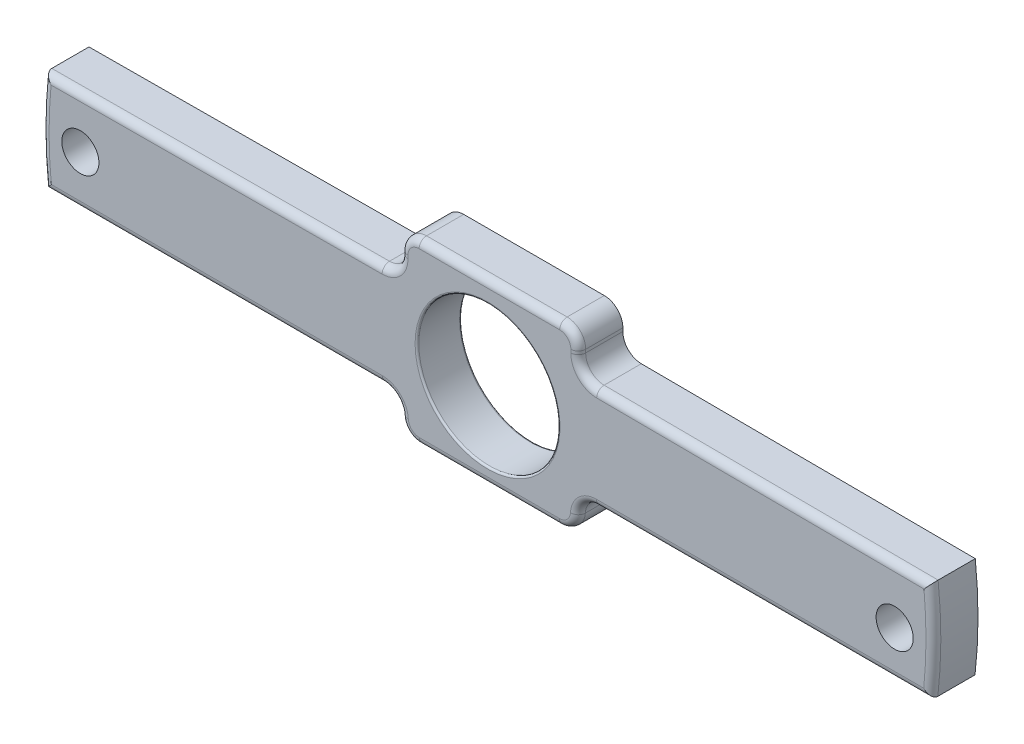
from build123d import *

# Parameters (mm, degrees)
ESQUISSE1_W             = 200
ESQUISSE1_H             = 24
BOSS_EXTRU_1_DEPTH      = 6
ESQUISSE3_R             = 9.5
ENL_V_MAT_EXTRU_1_DEPTH = 6
ESQUISSE4_R             = 114.275088212
ESQUISSE4_R_2           = 60
ENL_V_MAT_EXTRU_2_DEPTH = 6
ESQUISSE5_W             = 52.011744551
ESQUISSE5_H             = 15.54113196
ESQUISSE5_W_2           = 52.011744552
ENL_V_MAT_EXTRU_3_DEPTH = 6
CONG_1_R                = 2.5
CONG_2_R                = 2.5
CONG_3_R                = 1
CONG_4_R                = 0.25
CONG_5_R                = 0.25
ESQUISSE6_R             = 2.5
ENL_V_MAT_EXTRU_4_DEPTH = 68.365782888


with BuildPart() as part:
    # Esquisse1 → Boss.-Extru.1 (new body)
    with BuildSketch(Plane.XY):
        with Locations((-5.765391807, 0)):
            Rectangle(ESQUISSE1_W, ESQUISSE1_H)
    extrude(amount=BOSS_EXTRU_1_DEPTH)

    # Esquisse3 → Enlèv. mat.-Extru.1 (cut)
    with BuildSketch(Plane.XY.offset(6)):
        with Locations((-6.016275927, -0.323603958)):
            Circle(ESQUISSE3_R)
    extrude(amount=-ENL_V_MAT_EXTRU_1_DEPTH, mode=Mode.SUBTRACT)

    # Esquisse4 → Enlèv. mat.-Extru.2 (cut)
    with BuildSketch(Plane.XY.offset(6)):
        with Locations((-6.016275927, -0.323603958)):
            Circle(ESQUISSE4_R)
        with Locations((-6.016275927, -0.323603958)):
            Circle(ESQUISSE4_R_2, mode=Mode.SUBTRACT)
    extrude(amount=-ENL_V_MAT_EXTRU_2_DEPTH, mode=Mode.SUBTRACT)

    # Esquisse5 → Enlèv. mat.-Extru.3 (cut)
    with BuildSketch(Plane.XY.offset(6)):
        Polygon((-69.803207514, 21.817117384), (-17.792224869, 22.098641011), (-17.708105486, 6.557736709), (-69.719088132, 6.276213083), align=None)
        with Locations((-43.676559905, -15.038694091)):
            Rectangle(ESQUISSE5_W, ESQUISSE5_H)
        with Locations((32.145776291, -15.038694091)):
            Rectangle(ESQUISSE5_W_2, ESQUISSE5_H)
        Polygon((58.188304518, 6.276213083), (58.272423901, 21.817117384), (6.261441255, 22.098641011), (6.177321873, 6.557736709), align=None)
    extrude(amount=-ENL_V_MAT_EXTRU_3_DEPTH, mode=Mode.SUBTRACT)

    # Congé1
    cong_1_edges = [part.edges().sort_by_distance(p)[0] for p in [
        (-17.708105486, 6.557736709, 3),
        (6.139904015, -7.268128111, 3),
        (6.177321873, 6.557736709, 3),
        (-17.670687629, -7.268128111, 3),
    ]]
    fillet(cong_1_edges, radius=CONG_1_R)

    # Congé2
    cong_2_edges = [part.edges().sort_by_distance(p)[0] for p in [
        (6.206779607, 12, 3),
        (-17.73756322, 12, 3),
        (-17.670687629, -12, 3),
        (6.139904015, -12, 3),
    ]]
    fillet(cong_2_edges, radius=CONG_2_R)

    # Congé3
    cong_3_edges = [part.edges().sort_by_distance(p)[0] for p in [
        (31.147090613, 6.422581027, 6),
        (-42.891860863, -7.268128111, 6),
        (-17.722797632, 9.272084177, 6),
        (6.913507547, 7.285995677, 6),
        (-18.450972556, -7.953581317, 6),
        (-18.44429116, 7.285995677, 6),
        (-5.765391807, 12, 6),
        (6.192014019, 9.272084177, 6),
        (-5.765391807, -12, 6),
        (6.920188943, -7.953581317, 6),
        (5.366813532, -11.314546795, 6),
        (-16.897597145, -11.314546795, 6),
        (-16.996539353, 11.262976271, 6),
        (5.46575574, 11.262976271, 6),
        (53.983508026, -0.484618209, 6),
        (-66.016056196, -0.485985355, 6),
        (-42.928909262, 6.421222231, 6),
        (31.110193129, -7.268128111, 6),
    ]]
    fillet(cong_3_edges, radius=CONG_3_R)

    # Congé4
    cong_4_edges = [part.edges().sort_by_distance(p)[0] for p in [
        (-15.516275927, -0.323603958, 6),
    ]]
    fillet(cong_4_edges, radius=CONG_4_R)

    # Congé5
    cong_5_edges = [part.edges().sort_by_distance(p)[0] for p in [
        (-15.516275927, -0.323603958, 0),
    ]]
    fillet(cong_5_edges, radius=CONG_5_R)

    # Esquisse6 → Enlèv. mat.-Extru.4 (cut, through all)
    with BuildSketch(Plane.XY.offset(6)):
        with Locations((48.768783674, -1.17977957)):
            Circle(ESQUISSE6_R)
        with Locations((-60.807622013, -0.533809454)):
            Circle(ESQUISSE6_R)
    extrude(amount=-ENL_V_MAT_EXTRU_4_DEPTH, mode=Mode.SUBTRACT)


solid = part.part
